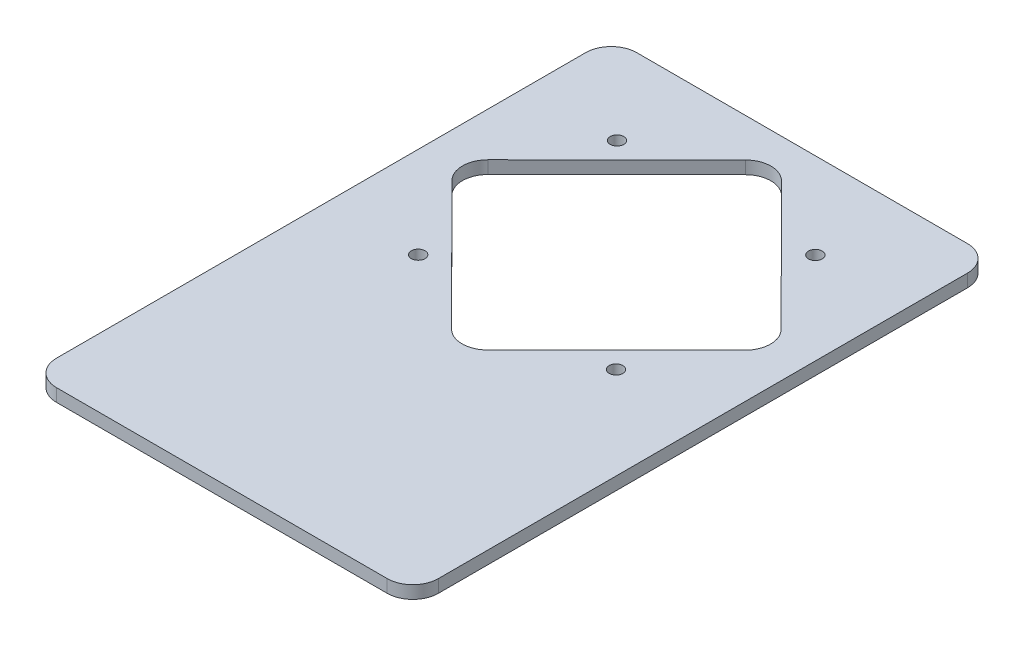
from build123d import *

# Parameters (mm, degrees)
SKETCH1_W           = 94.832
SKETCH1_H           = 144.105
SKETCH1_R           = 1.7
BOSS_EXTRUDE2_DEPTH = 3.175
FILLET1_R           = 6.35
FILLET2_R           = 6.35


with BuildPart() as part:
    # Sketch1 → Boss-Extrude2 (new body)
    with BuildSketch(Plane(origin=(0, 0, 0), x_dir=(1, 0, 0), z_dir=(0, 1, 0))):
        with Locations((47.416, 66.438639868)):
            Rectangle(SKETCH1_W, SKETCH1_H)
        with Locations(Location((22.7875, 117.150797893, 0), (0, 0, 270))):
            Circle(SKETCH1_R, mode=Mode.SUBTRACT)
        with Locations(Location((72.0445, 117.150797893, 0), (0, 0, 270))):
            Circle(SKETCH1_R, mode=Mode.SUBTRACT)
        with Locations(Location((71.919698828, 67.768996721, 0), (0, 0, 270))):
            Circle(SKETCH1_R, mode=Mode.SUBTRACT)
        with Locations(Location((22.662698828, 67.893797893, 0), (0, 0, 270))):
            Circle(SKETCH1_R, mode=Mode.SUBTRACT)
        Polygon((6.429841975, 92.522297893), (47.416, 133.383654746), (88.277356853, 92.397496721), (47.291198828, 51.536139868), align=None, mode=Mode.SUBTRACT)
    extrude(amount=BOSS_EXTRUDE2_DEPTH)

    # Fillet1
    fillet1_edges = [part.edges().sort_by_distance(p)[0] for p in [
        (47.416, 1.5875, -133.383654746),
        (6.429841975, 1.5875, -92.522297893),
        (47.291198828, 1.5875, -51.536139868),
        (88.277356853, 1.5875, -92.397496721),
    ]]
    fillet(fillet1_edges, radius=FILLET1_R)

    # Fillet2
    fillet2_edges = [part.edges().sort_by_distance(p)[0] for p in [
        (94.832, 1.5875, 5.613860132),
        (0, 1.5875, 5.613860132),
        (0, 1.5875, -138.491139868),
        (94.832, 1.5875, -138.491139868),
    ]]
    fillet(fillet2_edges, radius=FILLET2_R)


solid = part.part
